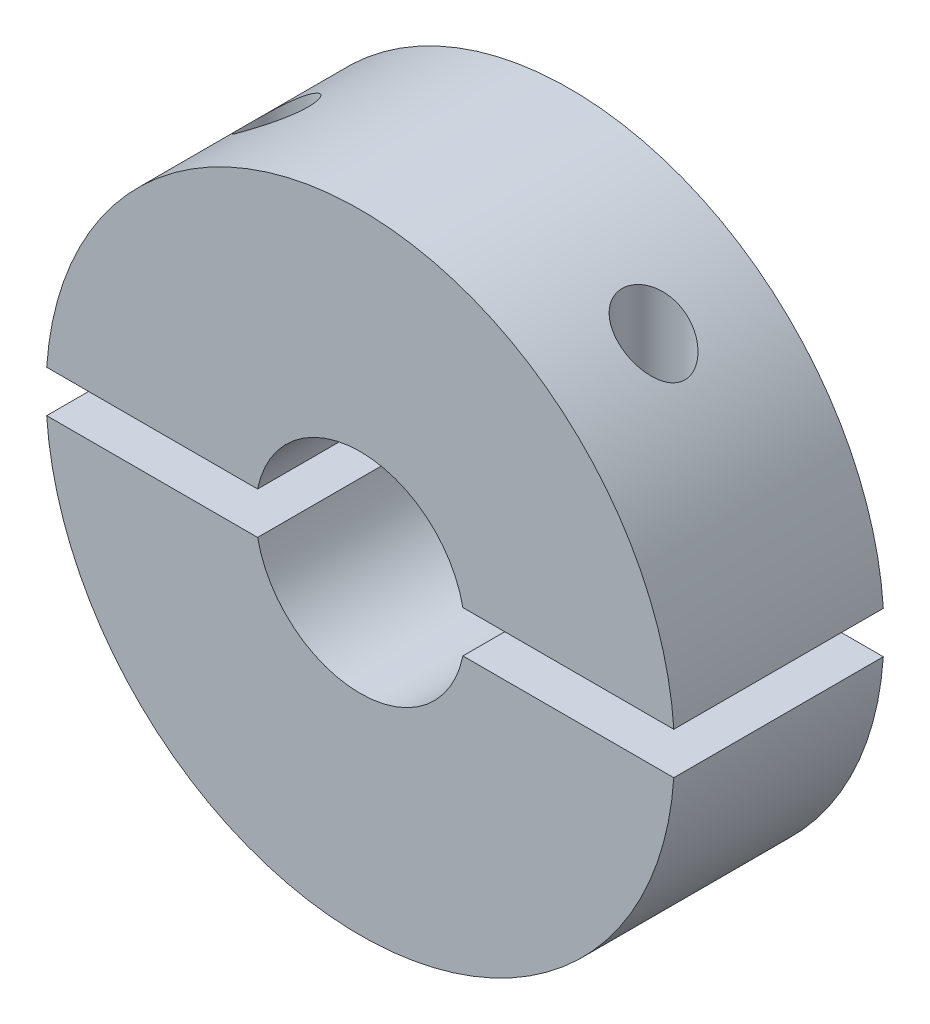
from build123d import *

# Parameters (mm, degrees)
SKETCH_1_R          = 15
SKETCH_1_R_2        = 5
EXTRUDE_1_DEPTH     = 5
SKETCH_2_W          = 45.571754554
SKETCH_2_H          = 2
CUT_EXTRUDE_1_DEPTH = 33
SKETCH_4_R          = 1.5
CUT_EXTRUDE_2_DEPTH = 41.5


with BuildPart() as part:
    # 草图1 → 凸台-拉伸1 (new, symmetric)
    with BuildSketch(Plane.XY):
        Circle(SKETCH_1_R)
        Circle(SKETCH_1_R_2, mode=Mode.SUBTRACT)
    extrude(amount=EXTRUDE_1_DEPTH, both=True)

    # 草图2 → 切除-拉伸1 (cut)
    with BuildSketch(Plane.XY.offset(5)):
        Rectangle(SKETCH_2_W, SKETCH_2_H)
    extrude(amount=-CUT_EXTRUDE_1_DEPTH, mode=Mode.SUBTRACT)


with BuildPart() as cut_extrude_1_piece_1:
    # of the separate pieces the step leaves, piece 1, a body of its own (cut_extrude_1_pieces)
    add(part.part.solids().sort_by_distance((14.966629547, 1, -5))[0])


with BuildPart() as cut_extrude_1_piece_2:
    # of the separate pieces the step leaves, piece 2, a body of its own (cut_extrude_1_pieces)
    add(part.part.solids().sort_by_distance((-14.966629547, -1, -5))[0])


with BuildPart() as cut_extrude_2_tool:
    # 草图4 → 切除-拉伸2 (new, symmetric)
    with BuildSketch(Plane(origin=(0, 0, 0), x_dir=(1, 0, 0), z_dir=(0, 1, 0))):
        with Locations(Location((9, 0, 0), (0, 0, 270))):
            Circle(SKETCH_4_R)
        with Locations(Location((-9, 0, 0), (0, 0, 270))):
            Circle(SKETCH_4_R)
    extrude(amount=CUT_EXTRUDE_2_DEPTH, both=True)


with BuildPart() as cut_extrude_1_piece_1_1:
    add(cut_extrude_1_piece_1.part)

    # 切除-拉伸2: cut by cut_extrude_2_tool
    add(cut_extrude_2_tool.part, mode=Mode.SUBTRACT)


with BuildPart() as cut_extrude_1_piece_2_1:
    add(cut_extrude_1_piece_2.part)

    # 切除-拉伸2: cut by cut_extrude_2_tool
    add(cut_extrude_2_tool.part, mode=Mode.SUBTRACT)


solid = Compound([cut_extrude_1_piece_1_1.part, cut_extrude_1_piece_2_1.part])
